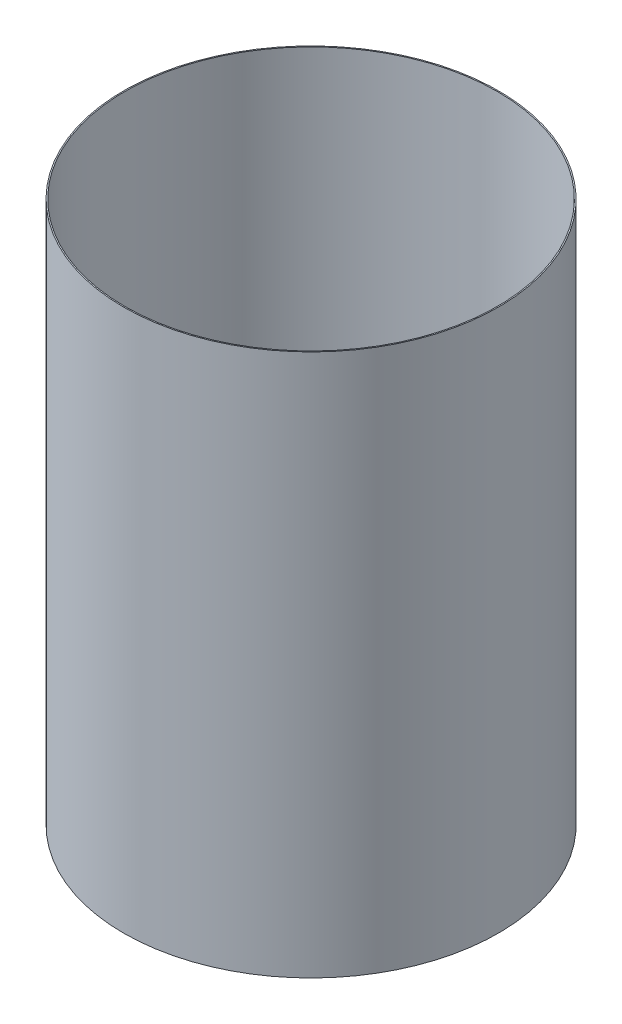
from build123d import *

# Parameters (mm, degrees)
SKETCH1_W = 0.05
SKETCH1_H = 23


with BuildPart() as part:
    # Sketch1 → Revolve1 (revolve)
    with BuildSketch(Plane(origin=(0, 0, 0), x_dir=(-1, 0, 0), z_dir=(0, 0, -1)), mode=Mode.PRIVATE) as revolve1_sk:
        with Locations((-7.925, 70)):
            Rectangle(SKETCH1_W, SKETCH1_H)
    revolve(revolve1_sk.sketch.rotate(Axis((0, 58.5, 0), (0, 1, 0)), 270), axis=Axis((0, 58.5, 0), (0, 1, 0)))


solid = part.part
